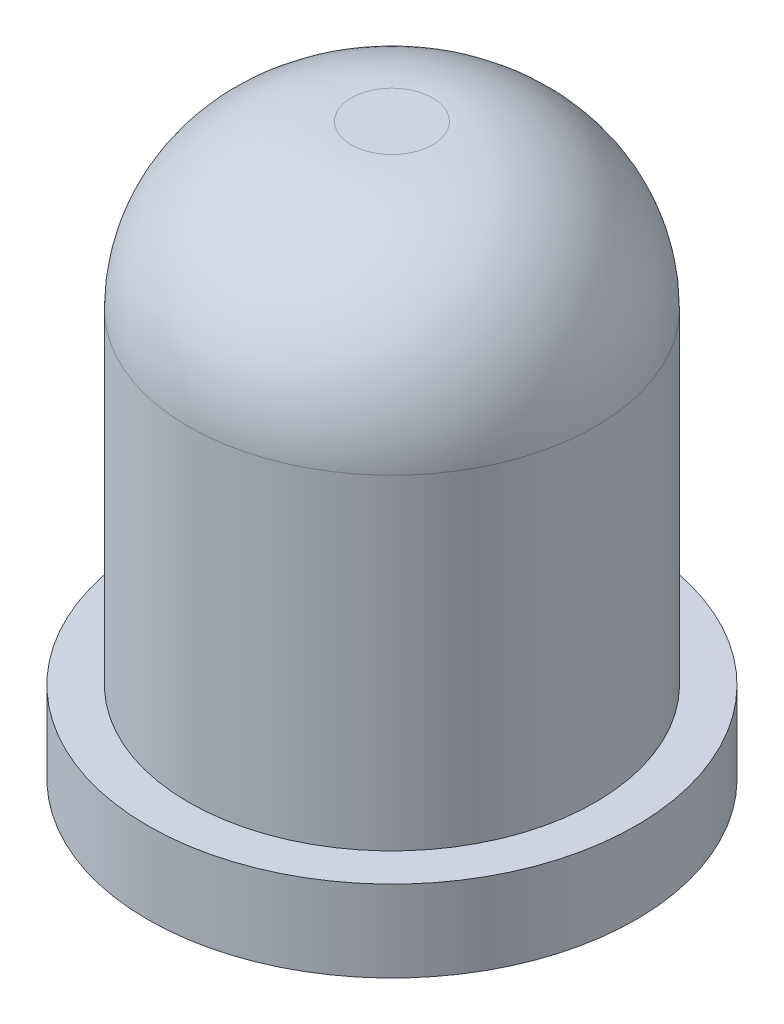
from build123d import *

# Parameters (mm, degrees)
SKETCH2_R           = 3
BOSS_EXTRUDE1_DEPTH = 1
SKETCH3_R           = 2.5
BOSS_EXTRUDE2_DEPTH = 6
FILLET1_R           = 2


with BuildPart() as part:
    # Sketch2 → Boss-Extrude1 (new body)
    with BuildSketch(Plane(origin=(0, 0, 0), x_dir=(1, 0, 0), z_dir=(0, 1, 0))):
        with Locations(Location((0, 0, 0), (0, 0, 270))):
            Circle(SKETCH2_R)
    extrude(amount=BOSS_EXTRUDE1_DEPTH)

    # Sketch3 → Boss-Extrude2 (add)
    with BuildSketch(Plane(origin=(0, 1, 0), x_dir=(1, 0, 0), z_dir=(0, 1, 0))):
        with Locations(Location((0, 0, 0), (0, 0, 270))):
            Circle(SKETCH3_R)
    extrude(amount=BOSS_EXTRUDE2_DEPTH)

    # Fillet1
    fillet1_edges = [part.edges().sort_by_distance(p)[0] for p in [
        (0, 7, -2.5),
    ]]
    fillet(fillet1_edges, radius=FILLET1_R)


solid = part.part
